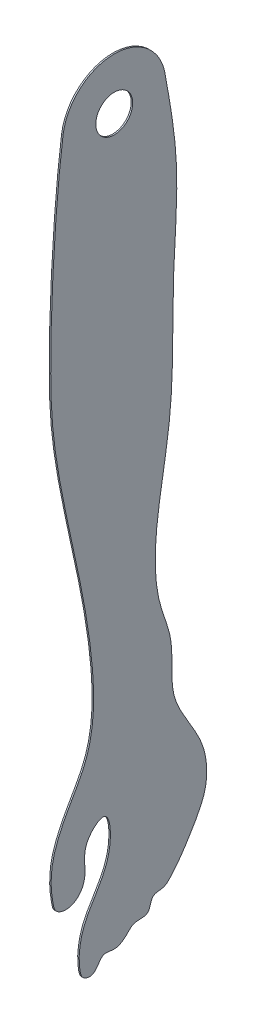
from build123d import *

# Parameters (mm, degrees)
SKETCH3_R      = 12.5
EXTRUDE1_DEPTH = 0.5


with BuildPart() as part:
    # Sketch3 → Extrude1 (new, symmetric)
    with BuildSketch(Plane(origin=(0, 0, 0), x_dir=(0, 0, -1), z_dir=(1, 0, 0))):
        with BuildLine():
            ThreePointArc((34.76874317, 4.016777114), (0.416676232, 34.99751964), (-34.663254663, 4.843426076))
            add(Edge.make_bspline(
                [(-34.663254663, 4.843426076), (-39.209714315, -27.694510141), (-43.825343792, -94.602341537), (-41.948190567, -198.598302488), (-14.255963637, -277.322783369), (-12.639234826, -368.678198152), (-34.777858781, -395.489292519), (-43.996198222, -424.363716063), (-42.443373952, -438.49294741), (-40.054241945, -449.393516044), (-28.647158969, -452.844976713), (-15.862650521, -438.487431053), (-24.617151832, -420.969365899), (-4.10890141, -402.825630117), (0.432349692, -441.301358899), (-22.179576198, -457.553565045), (-24.634968518, -486.558139521), (-21.749033124, -497.149262831), (-12.291652886, -500.057224659), (-9.376910639, -487.522190972), (1.211922473, -491.594407947), (7.896611292, -486.857235759), (13.426750849, -480.101469825), (24.466301456, -483.037631145), (24.597900402, -470.049165917), (33.125717084, -471.666382451), (42.756336764, -462.941926345), (57.421857927, -439.795919171), (63.596628525, -421.922104704), (62.093643724, -393.728942846), (34.906366376, -366.180340211), (41.470083699, -330.24600303), (19.359795854, -279.816511077), (42.209289784, -206.310424789), (38.185359086, -121.859738432), (44.923809903, -53.382043051), (38.078302419, -13.991670617), (34.76874317, 4.016777114)],
                knots=[0, 0, 0, 0, 0.081281688, 0.10090037, 0.196186818, 0.230170317, 0.256809284, 0.261911269, 0.279048066, 0.28214694, 0.290757909, 0.303690758, 0.325214073, 0.338388057, 0.352847421, 0.397122284, 0.418552513, 0.421852215, 0.430119303, 0.4429123, 0.451129664, 0.462260478, 0.468901072, 0.480315632, 0.490025771, 0.499359223, 0.503696537, 0.530098647, 0.536467207, 0.56408187, 0.611865288, 0.64690257, 0.670168968, 0.781143972, 0.870016231, 0.937879507, 0.99509795, 0.99509795, 0.99509795, 0.99509795], degree=3))
        make_face()
        Circle(SKETCH3_R, mode=Mode.SUBTRACT)
    extrude(amount=EXTRUDE1_DEPTH, both=True)


solid = part.part
